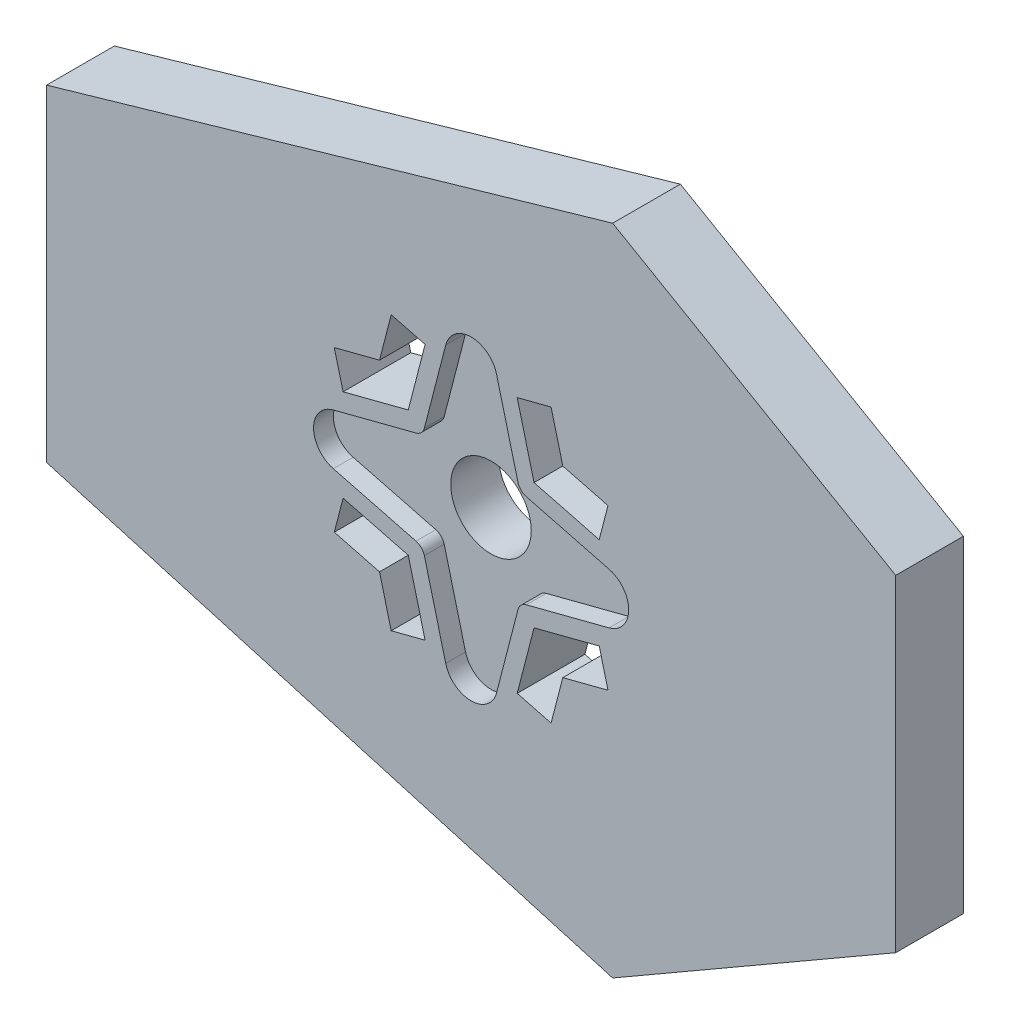
from build123d import *

# Parameters (mm, degrees)
SKETCH1_R            = 3.45
BOSS_EXTRUDE1_DEPTH  = 4.1
BOSS_EXTRUDE2_DEPTH  = 5.8
CUT_EXTRUDE1_DEPTH   = 51.416317693
MIRROR2_COPY_1_DEPTH = 51.416317693


with BuildPart() as part:
    # Sketch1 → Boss-Extrude1 (new body)
    with BuildSketch(Plane.XY):
        Polygon((6.974355653, -28), (-41.523066959, -14), (-41.523066959, 14), (6.974355653, 28), (31.223066959, 14), (31.223066959, -14), align=None)
        with Locations((-5.15, 0)):
            Circle(SKETCH1_R, mode=Mode.SUBTRACT)
    extrude(amount=BOSS_EXTRUDE1_DEPTH)

    # Sketch1<3> → Boss-Extrude2 (add)
    with BuildSketch(Plane.XY):
        Polygon((-41.523066959, -14), (6.974355653, -28), (31.223066959, -14), (31.223066959, 14), (6.974355653, 28), (-41.523066959, 14), align=None)
        with BuildLine():
            Line((-1.14034217, -4.727614303), (-2.971580528, -11.813017409))
            ThreePointArc((-2.971580528, -11.813017409), (-5.15, -13.5), (-7.328419472, -11.813017409))
            Line((-7.328419472, -11.813017409), (-9.15965783, -4.727614303))
            ThreePointArc((-9.15965783, -4.727614303), (-9.420737481, -4.270737481), (-9.877614303, -4.00965783))
            Line((-9.877614303, -4.00965783), (-16.963017409, -2.178419472))
            ThreePointArc((-16.963017409, -2.178419472), (-18.65, 0), (-16.963017409, 2.178419472))
            Line((-16.963017409, 2.178419472), (-9.877614303, 4.00965783))
            ThreePointArc((-9.877614303, 4.00965783), (-9.420737481, 4.270737481), (-9.15965783, 4.727614303))
            Line((-9.15965783, 4.727614303), (-7.328419472, 11.813017409))
            ThreePointArc((-7.328419472, 11.813017409), (-5.15, 13.5), (-2.971580528, 11.813017409))
            Line((-2.971580528, 11.813017409), (-1.14034217, 4.727614303))
            ThreePointArc((-1.14034217, 4.727614303), (-0.879262519, 4.270737481), (-0.422385697, 4.00965783))
            Line((-0.422385697, 4.00965783), (6.663017409, 2.178419472))
            ThreePointArc((6.663017409, 2.178419472), (8.35, 0), (6.663017409, -2.178419472))
            Line((6.663017409, -2.178419472), (-0.422385697, -4.00965783))
            ThreePointArc((-0.422385697, -4.00965783), (-0.879262519, -4.270737481), (-1.14034217, -4.727614303))
        make_face(mode=Mode.SUBTRACT)
    extrude(amount=BOSS_EXTRUDE2_DEPTH)

    # Sketch3 → Cut-Extrude1 (cut, through all)
    with BuildSketch(Plane.XY.offset(5.8)):
        Polygon((-13.000425446, 7.850425446), (-16.873171174, 6.849505608), (-16.122481296, 3.944946311), (-10.538213003, 5.388213003), (-9.094946311, 10.972481296), (-11.999505608, 11.723171174), align=None)
    cut_extrude1 = extrude(amount=-CUT_EXTRUDE1_DEPTH, mode=Mode.SUBTRACT)

    # Mirror1: Cut-Extrude1 across plane
    add(cut_extrude1.mirror(Plane.ZY.offset(5.15)), mode=Mode.SUBTRACT)

    # Mirror2: Cut-Extrude1 across plane
    add(cut_extrude1.mirror(Plane(origin=(0, 0, 0), x_dir=(0, 0, 1), z_dir=(0, -1, 0))), mode=Mode.SUBTRACT)

    # Mirror2 copy 1 sketch → Mirror2 copy 1 (cut, through all)
    with BuildSketch(Plane(origin=(-10.3, 0, 5.8), x_dir=(-1, 0, 0), z_dir=(0, 0, 1))):
        Polygon((-13.000425446, 7.850425446), (-16.873171174, 6.849505608), (-16.122481296, 3.944946311), (-10.538213003, 5.388213003), (-9.094946311, 10.972481296), (-11.999505608, 11.723171174), align=None)
    extrude(amount=-MIRROR2_COPY_1_DEPTH, mode=Mode.SUBTRACT)


solid = part.part
